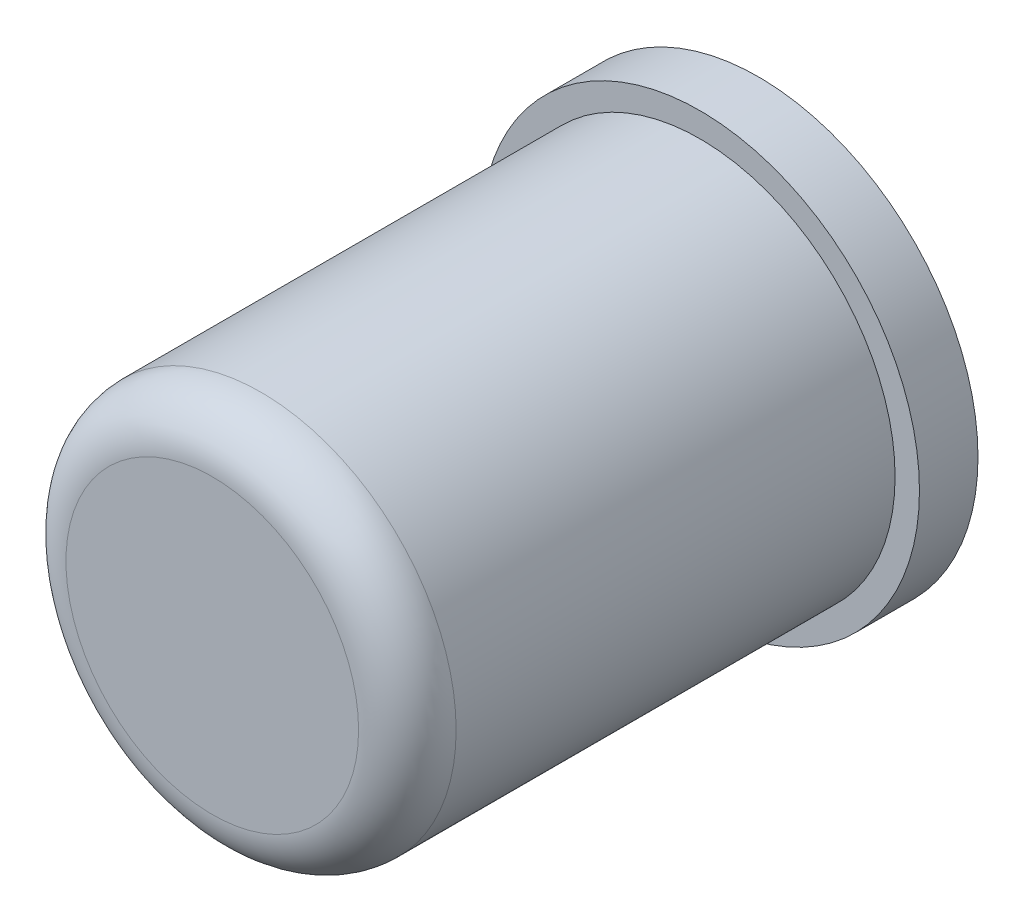
from build123d import *

# Parameters (mm, degrees)
SKETCH_1_R      = 4.5
EXTRUDE_1_DEPTH = 1.2
SKETCH_2_R      = 4
EXTRUDE_2_DEPTH = 10
FILLET_1_R      = 1


with BuildPart() as part:
    # 草图1 → 凸台-拉伸1 (new body)
    with BuildSketch(Plane.XY):
        Circle(SKETCH_1_R)
    extrude(amount=EXTRUDE_1_DEPTH)

    # 草图2 → 凸台-拉伸2 (add)
    with BuildSketch(Plane.XY.offset(1.2)):
        Circle(SKETCH_2_R)
    extrude(amount=EXTRUDE_2_DEPTH)

    # 圆角1
    fillet_1_edges = [part.edges().sort_by_distance(p)[0] for p in [
        (-4, 0, 11.2),
    ]]
    fillet(fillet_1_edges, radius=FILLET_1_R)


solid = part.part
